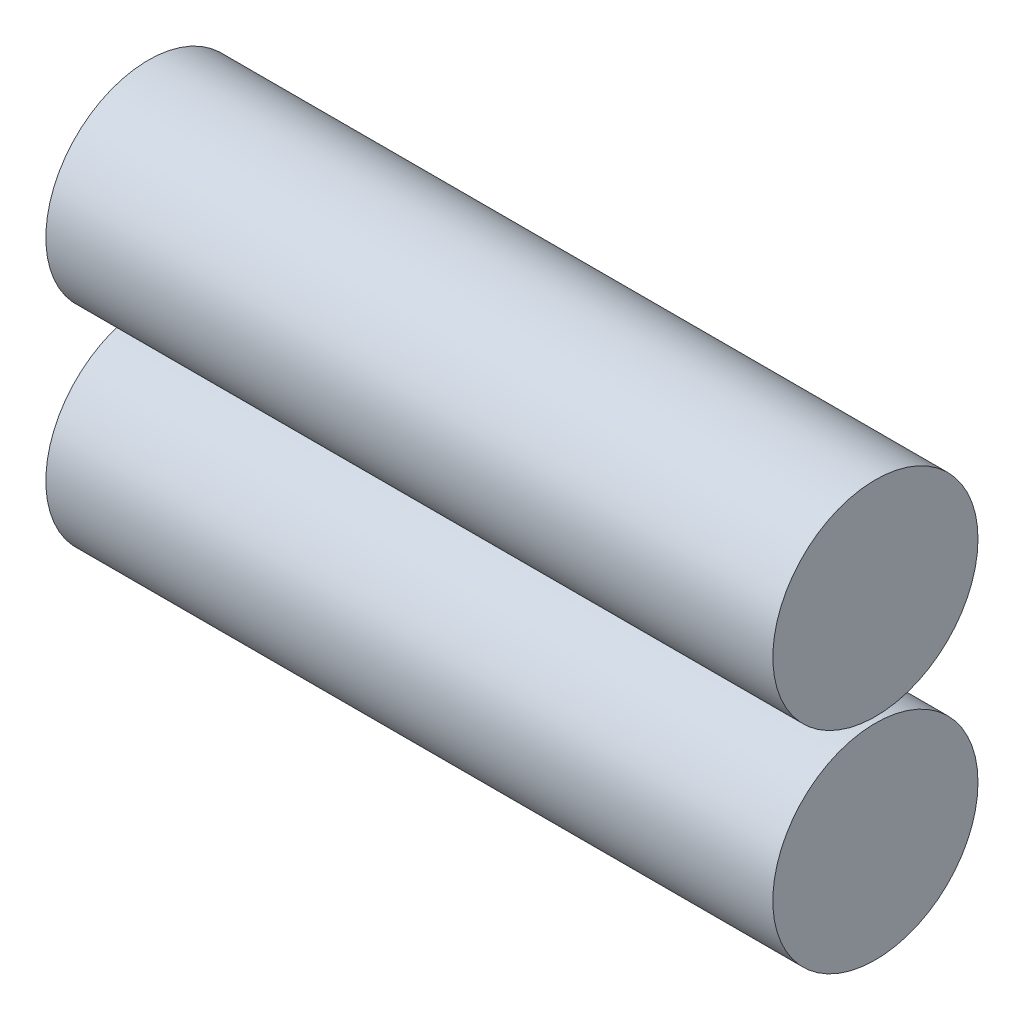
from build123d import *

# Parameters (mm, degrees)
SKETCH1_R           = 9.2
BOSS_EXTRUDE1_DEPTH = 65.2
SKETCH2_R           = 9.2
BOSS_EXTRUDE2_DEPTH = 65.2


with BuildPart() as part:
    # Sketch1 → Boss-Extrude1 (new body)
    with BuildSketch(Plane(origin=(-32.6, 0, 0), x_dir=(0, 0, -1), z_dir=(1, 0, 0))):
        with Locations((-14.2, -49.45)):
            Circle(SKETCH1_R)
    extrude(amount=BOSS_EXTRUDE1_DEPTH)


with BuildPart() as body_2:
    # Sketch2 → Boss-Extrude2 (new body)
    with BuildSketch(Plane(origin=(-32.6, 0, 0), x_dir=(0, 0, -1), z_dir=(1, 0, 0))):
        with Locations((-14.2, -30.55)):
            Circle(SKETCH2_R)
    extrude(amount=BOSS_EXTRUDE2_DEPTH)


solid = Compound([part.part, body_2.part])
